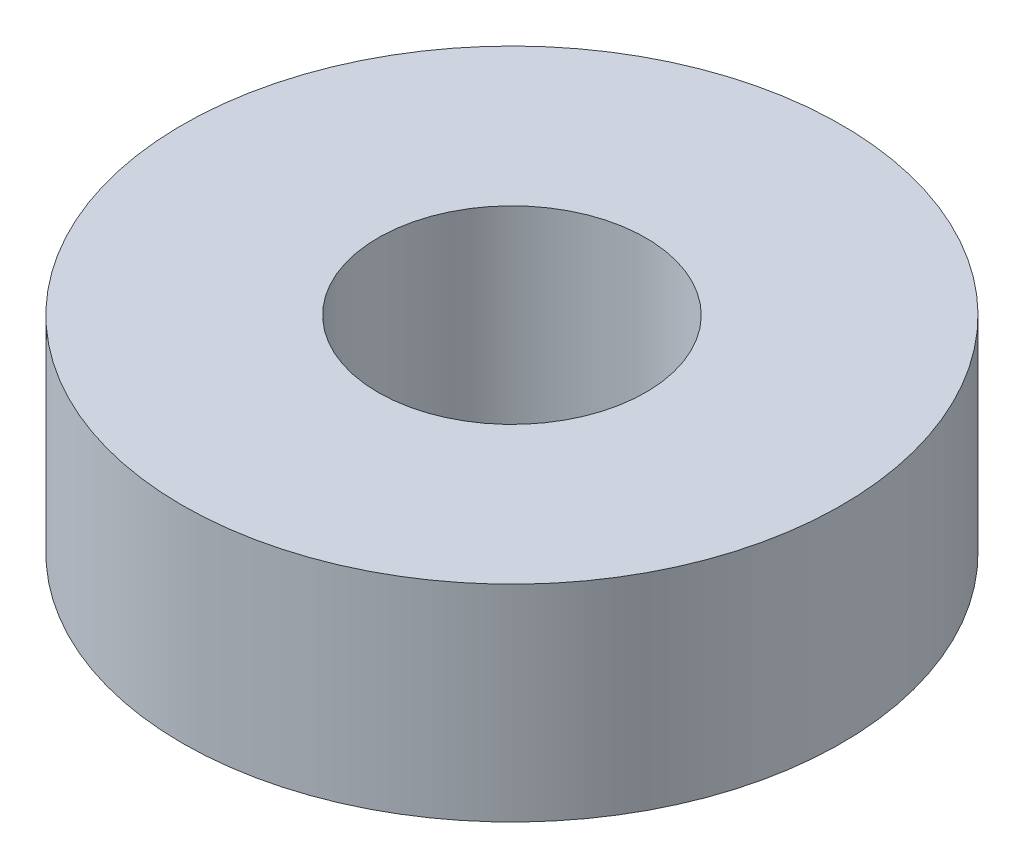
from build123d import *

# Parameters (mm, degrees)
SKETCH1_R           = 24
SKETCH1_R_2         = 9.75
BOSS_EXTRUDE1_DEPTH = 15


with BuildPart() as part:
    # Sketch1 → Boss-Extrude1 (new body)
    with BuildSketch(Plane(origin=(0, 0, 0), x_dir=(1, 0, 0), z_dir=(0, 1, 0))):
        with Locations(Location((0, 0, 0), (0, 0, 270))):
            Circle(SKETCH1_R)
        with Locations(Location((0, 0, 0), (0, 0, 270))):
            Circle(SKETCH1_R_2, mode=Mode.SUBTRACT)
    extrude(amount=BOSS_EXTRUDE1_DEPTH)


solid = part.part
